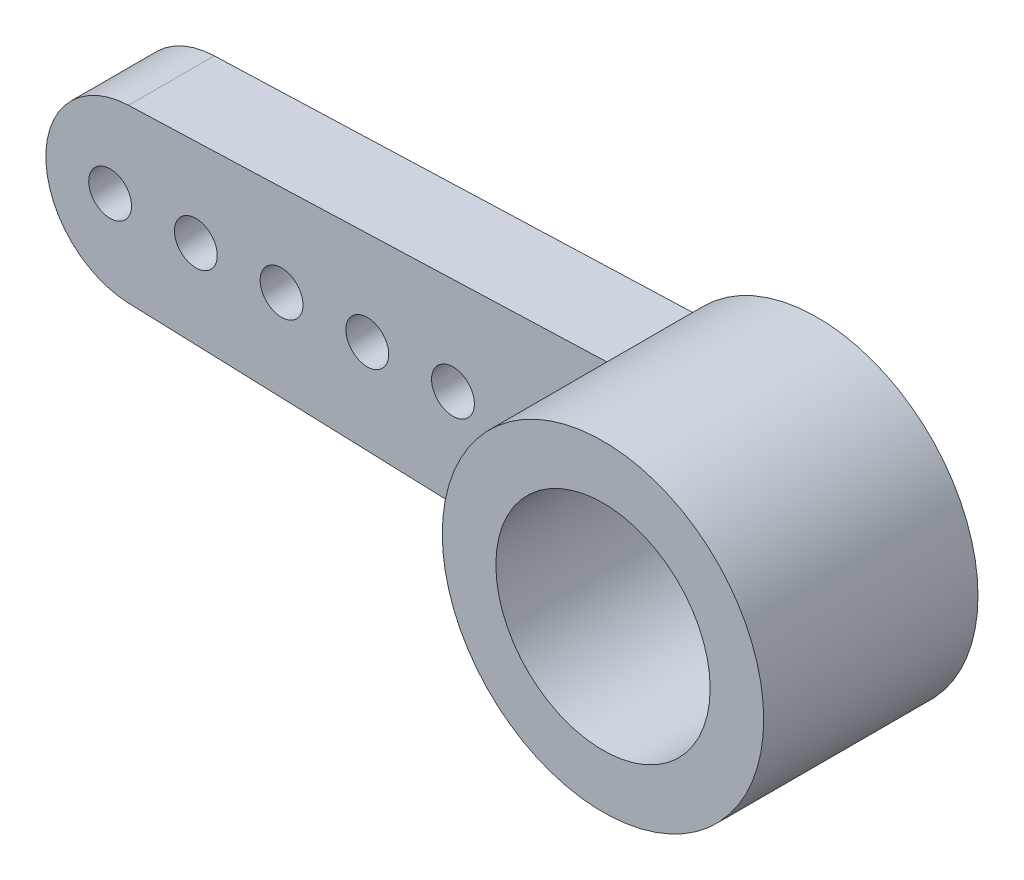
from build123d import *

# Parameters (mm, degrees)
EXTRUDE_3_DEPTH     = 2
EXTRUDE_3_2_DEPTH   = 2
SKETCH_2_R          = 3.75
SKETCH_2_R_2        = 2.5
EXTRUDE_5_DEPTH     = 3
EXTRUDE_START       = 2
SKETCH_3_R          = 3.75
SKETCH_3_R_2        = 2.5
EXTRUDE_6_DEPTH     = 2
SKETCH_4_R          = 0.5
CUT_EXTRUDE_1_DEPTH = 2
SKETCH_5_R          = 2.5
EXTRUDE_7_DEPTH     = 1
SKETCH_6_R          = 2.5
CUT_EXTRUDE_2_DEPTH = 0.5
SKETCH_7_R          = 1.25
CUT_EXTRUDE_3_DEPTH = 5
CUT_EXTRUDE1_DEPTH  = 18.177383386


with BuildPart() as part:
    # Эскиз1 → Бобышка-Вытянуть3 (new body)
    with BuildSketch(Plane.XY):
        with BuildLine():
            ThreePointArc((-2.88547071, -2.395111434), (-3.527252129, -1.273182005), (-3.75, 0))
            ThreePointArc((-3.75, 0), (-3.527252129, 1.273182005), (-2.88547071, 2.395111434))
            Line((-2.88547071, 2.395111434), (-14.07082784, 1.998745461))
            ThreePointArc((-14.07082784, 1.998745461), (-16, 0), (-14.07082784, -1.998745461))
            Line((-14.07082784, -1.998745461), (-2.88547071, -2.395111434))
        make_face()
    extrude(amount=EXTRUDE_3_DEPTH)



with BuildPart() as body_2:
    # Эскиз1 → Extrude 3 2 (new body)
    with BuildSketch(Plane.XY):
        with BuildLine():
            Line((14.07082784, 1.998745461), (2.88547071, 2.395111434))
            ThreePointArc((2.88547071, 2.395111434), (3.75, 0), (2.88547071, -2.395111434))
            Line((2.88547071, -2.395111434), (14.07082784, -1.998745461))
            ThreePointArc((14.07082784, -1.998745461), (16, 0), (14.07082784, 1.998745461))
        make_face()
    extrude(amount=EXTRUDE_3_2_DEPTH)


with BuildPart() as body_3:
    # Эскиз2 → Бобышка-Вытянуть5 (new body)
    with BuildSketch(Plane.XY.offset(2)):
        Circle(SKETCH_2_R)
        Circle(SKETCH_2_R_2, mode=Mode.SUBTRACT)
    extrude(amount=EXTRUDE_5_DEPTH)


with BuildPart() as part_1:
    add(part.part)

    add(body_2.part)  # Бобышка-Вытянуть6 merges body 2

    add(body_3.part)  # Бобышка-Вытянуть6 merges body 3
    # Эскиз3 → Бобышка-Вытянуть6 (add)
    with BuildSketch(Plane(origin=(0, 0, 2), x_dir=(-1, 0, 0), z_dir=(0, 0, -1)).offset(EXTRUDE_START)):
        with Locations(Location((0, 0, 0), (0, 0, 180))):
            Circle(SKETCH_3_R)
        with Locations(Location((0, 0, 0), (0, 0, 180))):
            Circle(SKETCH_3_R_2, mode=Mode.SUBTRACT)
    extrude(amount=-EXTRUDE_6_DEPTH)

    # Эскиз4 → Вырез-Вытянуть1 (cut)
    with BuildSketch(Plane(origin=(0, 0, 0), x_dir=(-1, 0, 0), z_dir=(0, 0, -1))):
        with Locations((-14.5, 0)):
            Circle(SKETCH_4_R)
        with Locations((-4.5, 0)):
            Circle(SKETCH_4_R)
        with Locations((-6.5, 0)):
            Circle(SKETCH_4_R)
        with Locations((-8.5, 0)):
            Circle(SKETCH_4_R)
        with Locations((-10.5, 0)):
            Circle(SKETCH_4_R)
        with Locations((-12.5, 0)):
            Circle(SKETCH_4_R)
        with Locations((4.5, 0)):
            Circle(SKETCH_4_R)
        with Locations((6.5, 0)):
            Circle(SKETCH_4_R)
        with Locations((8.5, 0)):
            Circle(SKETCH_4_R)
        with Locations((10.5, 0)):
            Circle(SKETCH_4_R)
        with Locations((12.5, 0)):
            Circle(SKETCH_4_R)
        with Locations((14.5, 0)):
            Circle(SKETCH_4_R)
    extrude(amount=-CUT_EXTRUDE_1_DEPTH, mode=Mode.SUBTRACT)

    # Эскиз5 → Бобышка-Вытянуть7 (add)
    with BuildSketch(Plane(origin=(0, 0, 0), x_dir=(-1, 0, 0), z_dir=(0, 0, -1))):
        with Locations(Location((0, 0, 0), (0, 0, 180))):
            Circle(SKETCH_5_R)
    extrude(amount=-EXTRUDE_7_DEPTH)

    # Эскиз6 → Вырез-Вытянуть2 (cut)
    with BuildSketch(Plane(origin=(0, 0, 0), x_dir=(-1, 0, 0), z_dir=(0, 0, -1))):
        with Locations(Location((0, 0, 0), (0, 0, 180))):
            Circle(SKETCH_6_R)
    extrude(amount=-CUT_EXTRUDE_2_DEPTH, mode=Mode.SUBTRACT)

    # Эскиз7 → Вырез-Вытянуть3 (cut)
    with BuildSketch(Plane(origin=(0, 0, 0.5), x_dir=(-1, 0, 0), z_dir=(0, 0, -1))):
        Circle(SKETCH_7_R)
    extrude(amount=-CUT_EXTRUDE_3_DEPTH, mode=Mode.SUBTRACT)

    # Sketch1 → Cut-Extrude1 (cut, through all)
    with BuildSketch(Plane.XY.offset(5)):
        with BuildLine():
            ThreePointArc((3.75, 0), (3.527252129, -1.273182005), (2.88547071, -2.395111434))
            Line((2.88547071, -2.395111434), (14.07082784, -1.998745461))
            ThreePointArc((14.07082784, -1.998745461), (16, 0), (14.07082784, 1.998745461))
            Line((14.07082784, 1.998745461), (2.88547071, 2.395111434))
            ThreePointArc((2.88547071, 2.395111434), (3.527252129, 1.273182005), (3.75, 0))
        make_face()
    extrude(amount=-CUT_EXTRUDE1_DEPTH, mode=Mode.SUBTRACT)


solid = part_1.part
